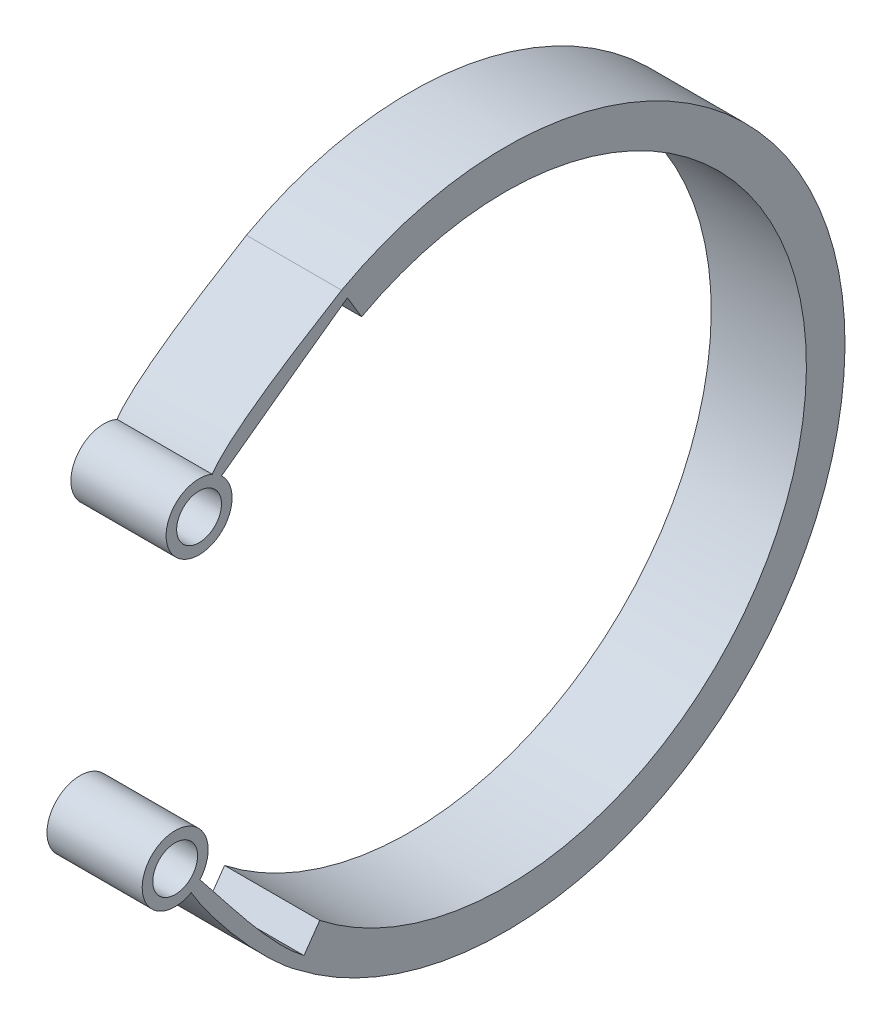
from build123d import *

# Parameters (mm, degrees)
SKETCH1_R           = 2.6924
BOSS_EXTRUDE1_DEPTH = 11.43


with BuildPart() as part:
    # Sketch1 → Boss-Extrude1 (new body)
    with BuildSketch(Plane(origin=(0, 0, 0), x_dir=(0, 0, -1), z_dir=(1, 0, 0))):
        with BuildLine():
            Line((-17.248379124, 31.777583848), (-18.961429782, 34.60046561))
            add(Edge.make_bspline(
                [(-18.961429782, 34.60046561), (-23.58056, 31.333147995), (-34.069402621, 23.636456001)],
                knots=[0, 0, 0, 1, 1, 1], degree=2))
            ThreePointArc((-34.069402621, 23.636456001), (-38.936367326, 17.418147401), (-35.185150313, 24.366750009))
            add(Edge.make_bspline(
                [(-19.655711627, 35.744550608), (-24.45282225, 32.833449755), (-33.10684296, 27.542000808), (-35.185150313, 24.366750009)],
                knots=[0, 0, 0, 0, 1, 1, 1, 1], degree=3))
            ThreePointArc((-19.655711627, 35.744550608), (40.669779942, -3.160521672), (-24.941927486, -32.278787942))
            add(Edge.make_bspline(
                [(-24.941927486, -32.278787942), (-28.90001234, -29.501694158), (-35.285813522, -22.100360431), (-37.707971273, -17.877142062)],
                knots=[0, 0, 0, 0, 1, 1, 1, 1], degree=3))
            ThreePointArc((-37.707971273, -17.877142062), (-42.120851326, -11.328768455), (-36.669004411, -17.041217359))
            add(Edge.make_bspline(
                [(-24.172835506, -31.182630753), (-28.247821961, -28.091199741), (-32.832203399, -21.809959197), (-36.669004411, -17.041217359)],
                knots=[0, 0, 0, 0, 1, 1, 1, 1], degree=3))
            Line((-24.172835506, -31.182630753), (-22.276314881, -28.479592921))
            ThreePointArc((-22.276314881, -28.479592921), (36.03168324, -3.006529649), (-17.248379124, 31.777583848))
        make_face()
        with Locations((-36.766350845, 20.733511971)):
            Circle(SKETCH1_R, mode=Mode.SUBTRACT)
        with Locations((-39.636960779, -14.415984273)):
            Circle(SKETCH1_R, mode=Mode.SUBTRACT)
    extrude(amount=BOSS_EXTRUDE1_DEPTH)


solid = part.part
